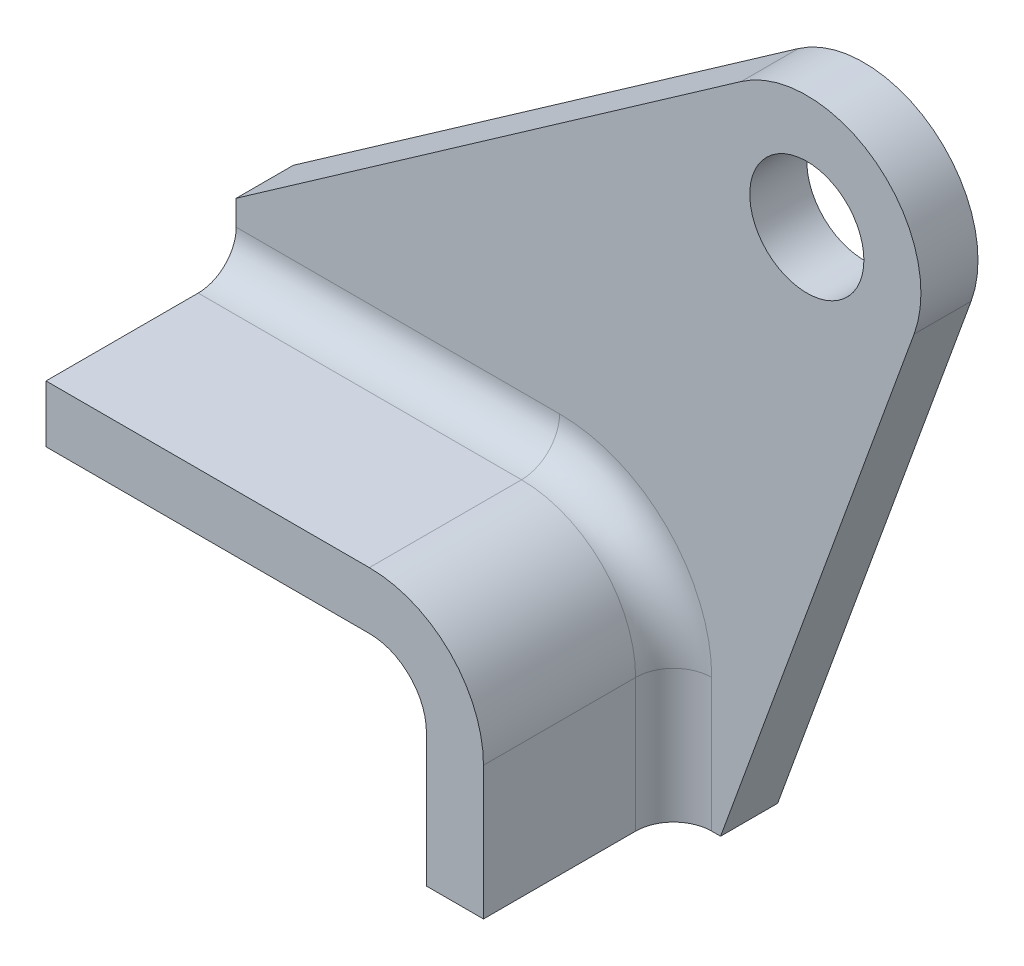
from build123d import *

# Parameters (mm, degrees)
SKETCH_1_R      = 6
EXTRUDE_1_DEPTH = 6
EXTRUDE_2_DEPTH = 20
FILLET_1_R      = 4


with BuildPart() as part:
    # Эскиз1 → Бобышка-Вытянуть1 (new body)
    with BuildSketch(Plane.XY):
        with BuildLine():
            Line((-40, 0), (-6, 0))
            ThreePointArc((-6, 0), (-1.757359313, -1.757359313), (0, -6))
            Line((0, -6), (0, -20))
            Line((0, -20), (10.931919214, -20))
            Line((10.931919214, -20), (31.276311449, 35.89575828))
            ThreePointArc((31.276311449, 35.89575828), (27.305137148, 49.520240083), (13.117082764, 49.829824531))
            Line((13.117082764, 49.829824531), (-40, 12.636842773))
            Line((-40, 12.636842773), (-40, 0))
        make_face()
        with Locations((20, 40)):
            Circle(SKETCH_1_R, mode=Mode.SUBTRACT)
    extrude(amount=EXTRUDE_1_DEPTH)

    # Эскиз2 → Бобышка-Вытянуть2 (add)
    with BuildSketch(Plane.XY.offset(6)):
        with BuildLine():
            Line((-40, 0), (-6, 0))
            ThreePointArc((-6, 0), (-1.757359313, -1.757359313), (0, -6))
            Line((0, -6), (0, -20))
            Line((0, -20), (6, -20))
            Line((6, -20), (6, -6))
            ThreePointArc((6, -6), (2.485281374, 2.485281374), (-6, 6))
            Line((-6, 6), (-40, 6))
            Line((-40, 6), (-40, 0))
        make_face()
    extrude(amount=EXTRUDE_2_DEPTH)

    # Скругление1
    fillet_1_edges = [part.edges().sort_by_distance(p)[0] for p in [
        (6, -13, 6),
        (2.485281374, 2.485281374, 6),
        (-23, 6, 6),
    ]]
    fillet(fillet_1_edges, radius=FILLET_1_R)


solid = part.part
